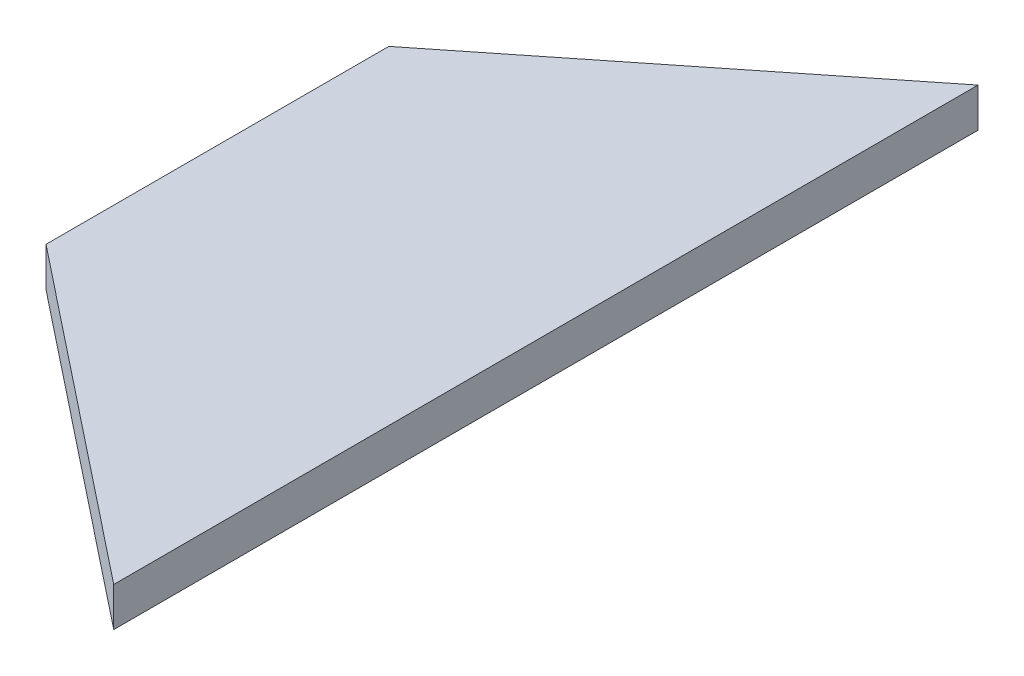
from build123d import *

# Parameters (mm, degrees)
SKETCH1_W           = 263.3434916
SKETCH1_H           = 204.19140391
BOSS_EXTRUDE1_DEPTH = 4.599999944
SKETCH2_OUTSIDE_W   = 331.995
SKETCH2_OUTSIDE_H   = 272.843
CUT_EXTRUDE1_DEPTH  = 334.264285513


with BuildPart() as part:
    # Sketch1 → Boss-Extrude1 (new body)
    with BuildSketch(Plane(origin=(0, 0, 0), x_dir=(1, 0, 0), z_dir=(0, 1, 0))):
        with Locations((131.6717458, 102.095701955)):
            Rectangle(SKETCH1_W, SKETCH1_H)
    extrude(amount=BOSS_EXTRUDE1_DEPTH)

    # Sketch2 outside → Cut-Extrude1 (cut, through all)
    with BuildSketch(Plane(origin=(0, 4.599999944, 0), x_dir=(1, 0, 0), z_dir=(0, 1, 0))):
        with Locations((131.6715, 102.0955)):
            Rectangle(SKETCH2_OUTSIDE_W, SKETCH2_OUTSIDE_H)
        Polygon((263.303589613, 123.438831994), (263.3434916, 21.7914039), (224.729550927, 52.441403941), (224.729550927, 92.741403859), align=None, mode=Mode.SUBTRACT)
    extrude(amount=-CUT_EXTRUDE1_DEPTH, mode=Mode.SUBTRACT)


solid = part.part
